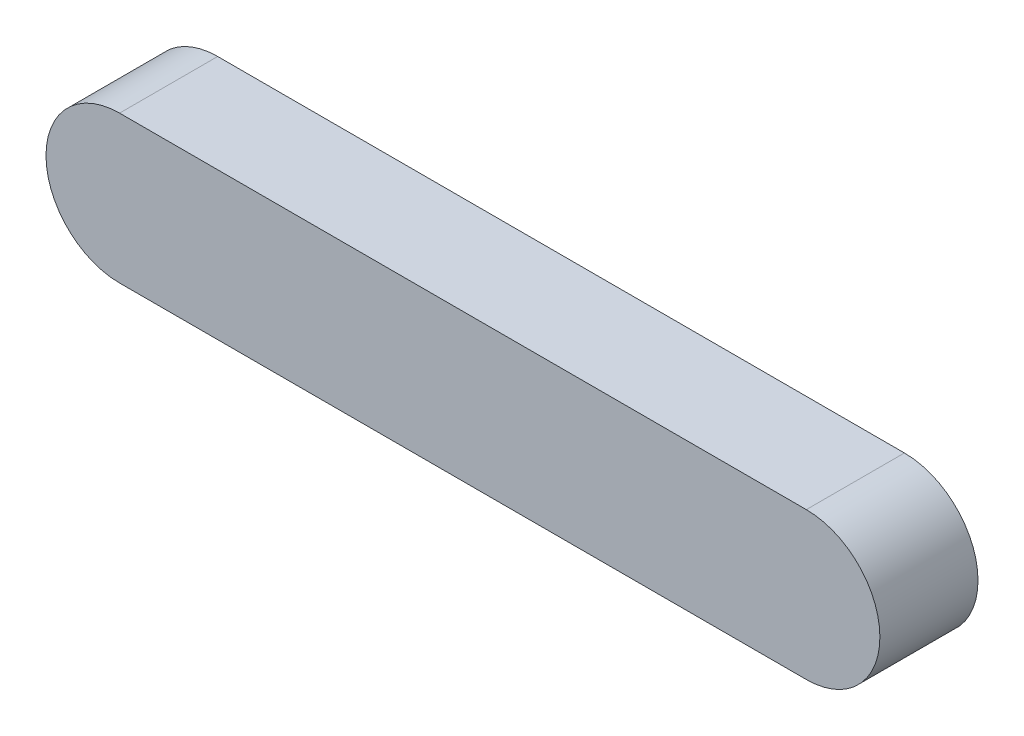
from build123d import *

# Parameters (mm, degrees)
EXTRUDE_1_DEPTH = 10


with BuildPart() as part:
    # 草图1 → 凸台-拉伸1 (new body)
    with BuildSketch(Plane.XY):
        with BuildLine():
            Line((70, -7.5), (0, -7.5))
            ThreePointArc((0, -7.5), (-7.5, 0), (0, 7.5))
            Line((0, 7.5), (70, 7.5))
            ThreePointArc((70, 7.5), (77.5, 0), (70, -7.5))
        make_face()
    extrude(amount=EXTRUDE_1_DEPTH)


solid = part.part
